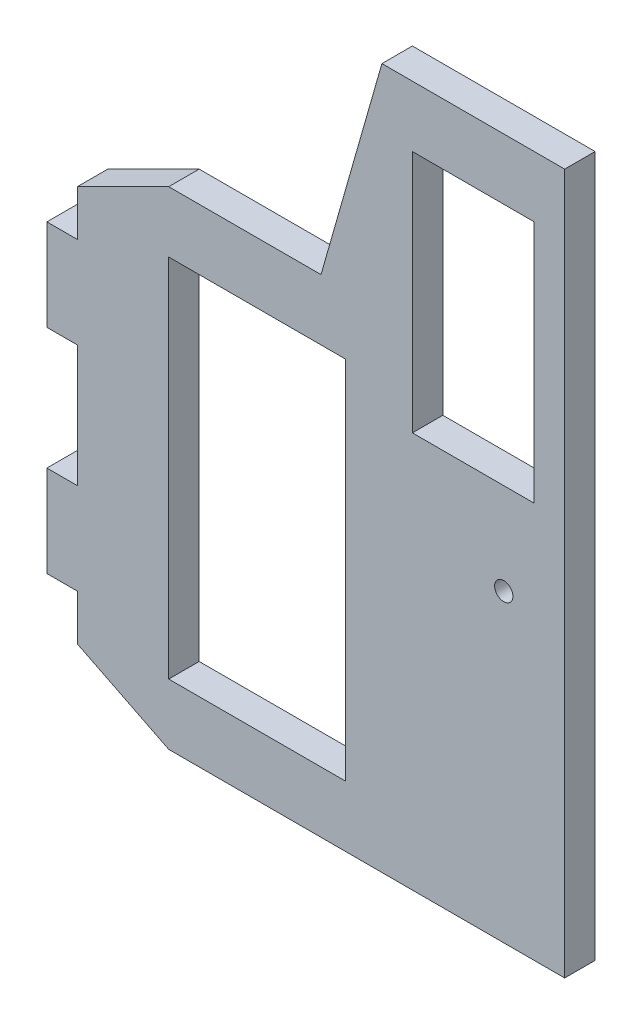
from build123d import *

# Parameters (mm, degrees)
BOSS_EXTRUDE1_DEPTH = 5
SKETCH2_W           = 29
SKETCH2_H           = 60
SKETCH2_W_2         = 20
SKETCH2_H_2         = 40
CUT_EXTRUDE1_DEPTH  = 5
SKETCH3_W           = 5
SKETCH3_H           = 15
BOSS_EXTRUDE2_DEPTH = 5
CUT_EXTRUDE2_DEPTH  = 5
SKETCH5_R           = 1.5
CUT_EXTRUDE3_DEPTH  = 5


with BuildPart() as part:
    # Sketch1 → Boss-Extrude1 (new body)
    with BuildSketch(Plane.XY):
        Polygon((0, 31.783783784), (10, 66.783783784), (40, 66.783783784), (40, 21.783783784), (40, -48.216216216), (-40, -48.216216216), (-40, 31.783783784), align=None)
    extrude(amount=BOSS_EXTRUDE1_DEPTH)

    # Sketch2 → Cut-Extrude1 (cut)
    with BuildSketch(Plane.XY.offset(5)):
        with Locations((-10.5, -8.216216216)):
            Rectangle(SKETCH2_W, SKETCH2_H)
        with Locations((25, 36.783783784)):
            Rectangle(SKETCH2_W_2, SKETCH2_H_2)
    extrude(amount=-CUT_EXTRUDE1_DEPTH, mode=Mode.SUBTRACT)

    # Sketch3 → Boss-Extrude2 (add)
    with BuildSketch(Plane.ZY.offset(40)):
        with Locations((2.5, 9.283783784)):
            Rectangle(SKETCH3_W, SKETCH3_H)
        with Locations((2.5, -25.716216216)):
            Rectangle(SKETCH3_W, SKETCH3_H)
    extrude(amount=BOSS_EXTRUDE2_DEPTH)

    # Sketch4 → Cut-Extrude2 (cut)
    with BuildSketch(Plane.XY.offset(5)):
        Polygon((-40, 31.783783784), (-25, 31.783783784), (-40, 24.283783784), align=None)
        Polygon((-40, -48.216216216), (-40, -40.716216216), (-25, -48.216216216), align=None)
    extrude(amount=-CUT_EXTRUDE2_DEPTH, mode=Mode.SUBTRACT)

    # Sketch5 → Cut-Extrude3 (cut)
    with BuildSketch(Plane.XY.offset(5)):
        with Locations((30, 1.783783784)):
            Circle(SKETCH5_R)
    extrude(amount=-CUT_EXTRUDE3_DEPTH, mode=Mode.SUBTRACT)


solid = part.part
